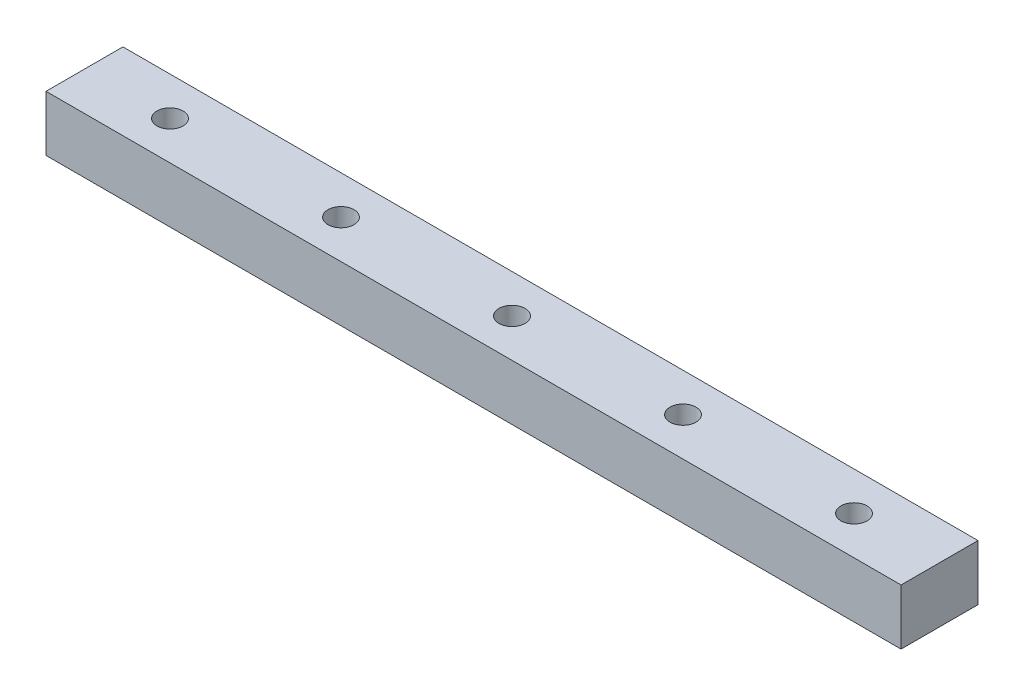
from build123d import *

# Parameters (mm, degrees)
SKETCH_1_W          = 9
SKETCH_1_H          = 6.5
EXTRUDE_1_DEPTH     = 100
SKETCH_2_R          = 1.525
CUT_EXTRUDE_1_DEPTH = 101.614362792


with BuildPart() as part:
    # 草图1 → 凸台-拉伸1 (new body)
    with BuildSketch(Plane(origin=(0, 0, 0), x_dir=(0, 0, -1), z_dir=(1, 0, 0))):
        with Locations((4.5, 3.25)):
            Rectangle(SKETCH_1_W, SKETCH_1_H)
    extrude(amount=EXTRUDE_1_DEPTH)

    # 草图2 → 切除-拉伸1 (cut, through all)
    with BuildSketch(Plane(origin=(0, 6.5, 0), x_dir=(1, 0, 0), z_dir=(0, 1, 0))):
        with Locations(Location((10, 4.5, 0), (0, 0, 270))):
            Circle(SKETCH_2_R)
        with Locations(Location((30, 4.5, 0), (0, 0, 270))):
            Circle(SKETCH_2_R)
        with Locations(Location((50, 4.5, 0), (0, 0, 270))):
            Circle(SKETCH_2_R)
        with Locations(Location((70, 4.5, 0), (0, 0, 270))):
            Circle(SKETCH_2_R)
        with Locations(Location((90, 4.5, 0), (0, 0, 270))):
            Circle(SKETCH_2_R)
    extrude(amount=-CUT_EXTRUDE_1_DEPTH, mode=Mode.SUBTRACT)


solid = part.part
